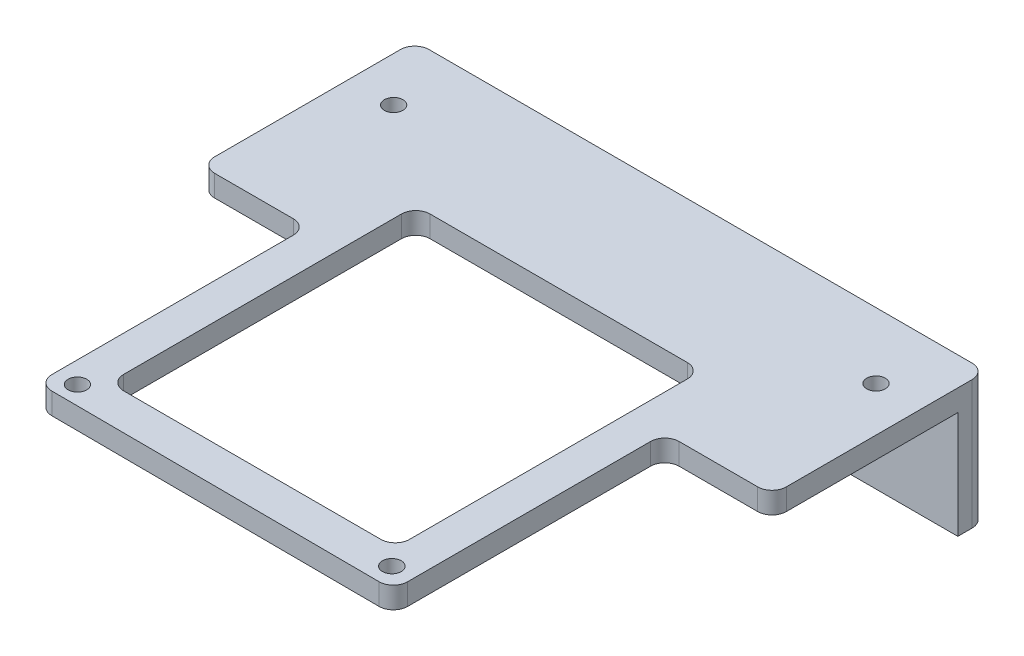
from build123d import *

# Parameters (mm, degrees)
SKETCH2_R           = 1.315325132
SKETCH2_R_2         = 1.3
BOSS_EXTRUDE1_DEPTH = 3
CUT_EXTRUDE1_DEPTH  = 10
BOSS_EXTRUDE3_DEPTH = 15
SKETCH6_R           = 2.2
CUT_EXTRUDE2_DEPTH  = 10


with BuildPart() as part:
    # Sketch2 → Boss-Extrude1 (new body)
    with BuildSketch(Plane.XZ):
        with BuildLine():
            Line((-23.009319596, 31.276283835), (22.990680404, 31.490636875))
            ThreePointArc((22.990680404, 31.490636875), (24.41091474, 30.908163296), (25, 29.490658589))
            Line((25, 29.490658589), (25, -4.5))
            ThreePointArc((25, -4.5), (25.585786438, -5.914213562), (27, -6.5))
            Line((27, -6.5), (38, -6.5))
            ThreePointArc((38, -6.5), (39.414213562, -7.085786438), (40, -8.5))
            Line((40, -8.5), (40, -34.5))
            ThreePointArc((40, -34.5), (39.414213562, -35.914213562), (38, -36.5))
            Line((38, -36.5), (-38, -36.5))
            ThreePointArc((-38, -36.5), (-39.414213562, -35.914213562), (-40, -34.5))
            Line((-40, -34.5), (-40, -8.5))
            ThreePointArc((-40, -8.5), (-39.414213562, -7.085786438), (-38, -6.5))
            Line((-38, -6.5), (-27, -6.5))
            ThreePointArc((-27, -6.5), (-25.585786438, -5.914213562), (-25, -4.5))
            Line((-25, -4.5), (-25, 29.276305549))
            ThreePointArc((-25, 29.276305549), (-24.417504708, 30.687220289), (-23.009319596, 31.276283835))
        make_face()
        with Locations(Location((22.009080877, 28.712344932, 0), (0, 0, 270))):
            Circle(SKETCH2_R, mode=Mode.SUBTRACT)
        with Locations(Location((-22, 28.7, 0), (0, 0, 270))):
            Circle(SKETCH2_R_2, mode=Mode.SUBTRACT)
        with Locations(Location((-33.75, -27.3, 0), (0, 0, 270))):
            Circle(SKETCH2_R_2, mode=Mode.SUBTRACT)
        with Locations(Location((33.75, -27.3, 0), (0, 0, 270))):
            Circle(SKETCH2_R_2, mode=Mode.SUBTRACT)
    extrude(amount=BOSS_EXTRUDE1_DEPTH)

    # Sketch3 → Cut-Extrude1 (cut)
    with BuildSketch(Plane.XZ.offset(3)):
        with BuildLine():
            Line((-18, 26.233664787), (18, 26.233664787))
            ThreePointArc((18, 26.233664787), (19.414213562, 25.64787835), (20, 24.233664787))
            Line((20, 24.233664787), (20, -14.643421245))
            ThreePointArc((20, -14.643421245), (19.414213562, -16.057634807), (18, -16.643421245))
            Line((18, -16.643421245), (-18, -16.643421245))
            ThreePointArc((-18, -16.643421245), (-19.414213562, -16.057634807), (-20, -14.643421245))
            Line((-20, -14.643421245), (-20, 24.233664787))
            ThreePointArc((-20, 24.233664787), (-19.414213562, 25.64787835), (-18, 26.233664787))
        make_face()
    extrude(amount=-CUT_EXTRUDE1_DEPTH, mode=Mode.SUBTRACT)

    # Sketch5 → Boss-Extrude3 (add)
    with BuildSketch(Plane.XZ.offset(3)):
        with BuildLine():
            Line((-40, -32.5), (40, -32.5))
            Line((40, -32.5), (40, -34.5))
            ThreePointArc((40, -34.5), (39.414213562, -35.914213562), (38, -36.5))
            Line((38, -36.5), (-38, -36.5))
            ThreePointArc((-38, -36.5), (-39.414213562, -35.914213562), (-40, -34.5))
            Line((-40, -34.5), (-40, -32.5))
        make_face()
    extrude(amount=BOSS_EXTRUDE3_DEPTH)

    # Sketch6 → Cut-Extrude2 (cut)
    with BuildSketch(Plane.XY.offset(-32.5)):
        with Locations((-25, -10.5)):
            Circle(SKETCH6_R)
        with Locations((25, -10.5)):
            Circle(SKETCH6_R)
    extrude(amount=-CUT_EXTRUDE2_DEPTH, mode=Mode.SUBTRACT)


solid = part.part
